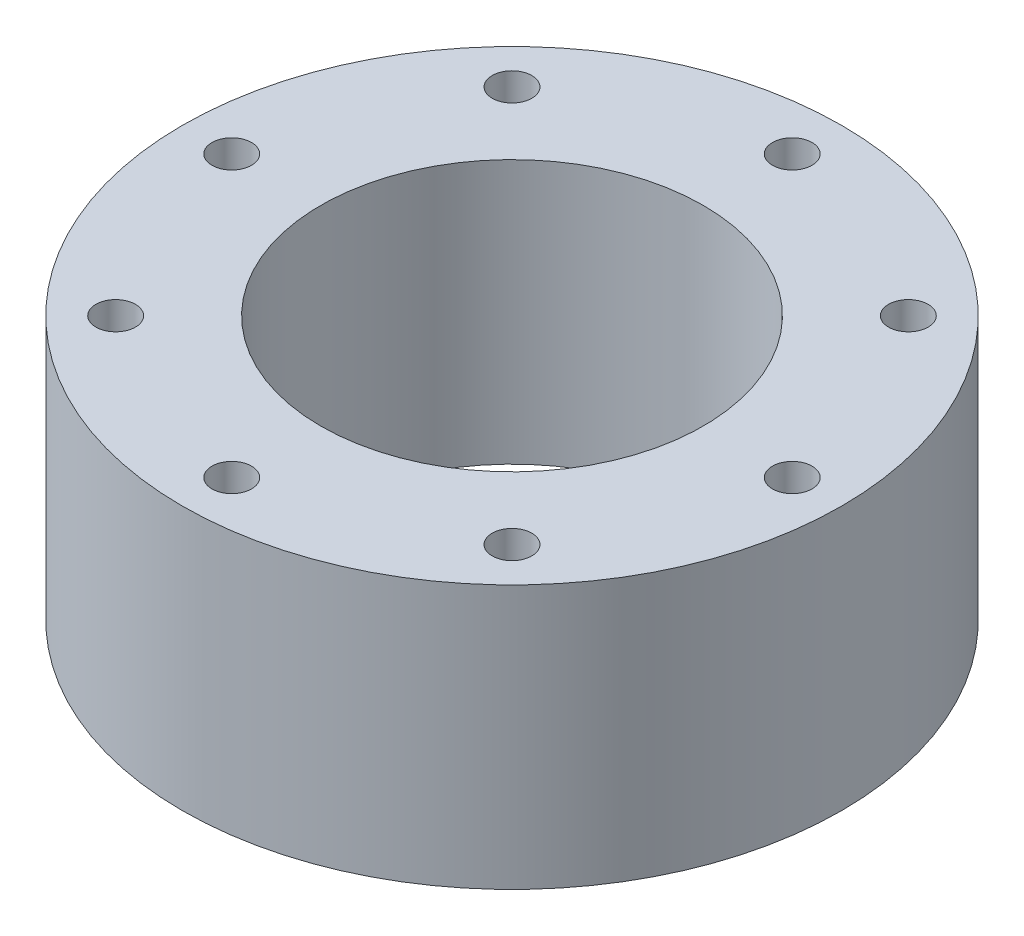
from build123d import *

# Parameters (mm, degrees)
SKETCH1_R           = 25
SKETCH1_R_2         = 1.5
SKETCH1_R_3         = 14.5
BOSS_EXTRUDE1_DEPTH = 10


with BuildPart() as part:
    # Sketch1 → Boss-Extrude1 (new, symmetric)
    with BuildSketch(Plane(origin=(0, 0, 0), x_dir=(1, 0, 0), z_dir=(0, 1, 0))):
        with Locations(Location((0, 0, 0), (0, 0, 270))):
            Circle(SKETCH1_R)
        with Locations(Location((0, -21.25, 0), (0, 0, 270))):
            Circle(SKETCH1_R_2, mode=Mode.SUBTRACT)
        with Locations(Location((-15.0260191, -15.0260191, 0), (0, 0, 270))):
            Circle(SKETCH1_R_2, mode=Mode.SUBTRACT)
        with Locations(Location((-21.25, 0, 0), (0, 0, 270))):
            Circle(SKETCH1_R_2, mode=Mode.SUBTRACT)
        with Locations(Location((-15.0260191, 15.0260191, 0), (0, 0, 270))):
            Circle(SKETCH1_R_2, mode=Mode.SUBTRACT)
        with Locations(Location((0, 21.25, 0), (0, 0, 270))):
            Circle(SKETCH1_R_2, mode=Mode.SUBTRACT)
        with Locations(Location((15.0260191, 15.0260191, 0), (0, 0, 270))):
            Circle(SKETCH1_R_2, mode=Mode.SUBTRACT)
        with Locations(Location((21.25, 0, 0), (0, 0, 270))):
            Circle(SKETCH1_R_2, mode=Mode.SUBTRACT)
        with Locations(Location((15.0260191, -15.0260191, 0), (0, 0, 270))):
            Circle(SKETCH1_R_2, mode=Mode.SUBTRACT)
        with Locations(Location((0, 0, 0), (0, 0, 270))):
            Circle(SKETCH1_R_3, mode=Mode.SUBTRACT)
    extrude(amount=BOSS_EXTRUDE1_DEPTH, both=True)


solid = part.part
